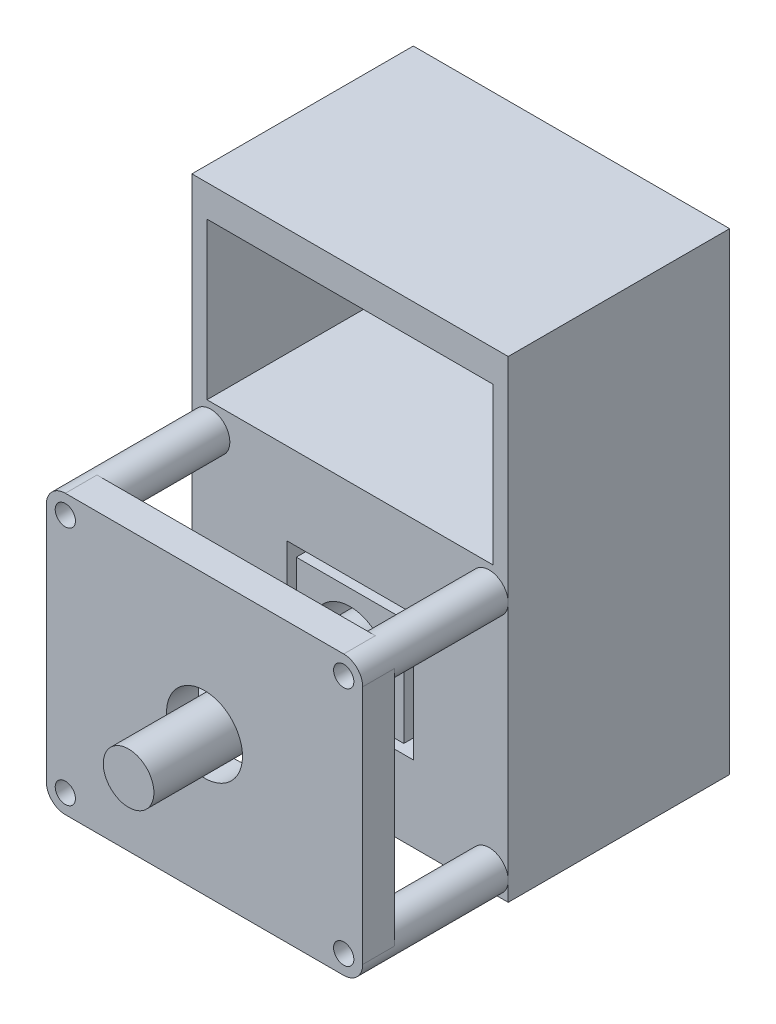
from build123d import *

# Parameters (mm, degrees)
SKETCH_2_W           = 50
SKETCH_2_H           = 74.720339059
SKETCH_2_R           = 1.6
SKETCH_2_W_2         = 20
SKETCH_2_H_2         = 20
SKETCH_2_W_3         = 45.23
SKETCH_2_H_3         = 24.73
EXTRUDE_1_DEPTH      = 35
SKETCH_2_W_4         = 17
SKETCH_2_H_4         = 17
SKETCH_2_R_2         = 6
EXTRUDE_1_2_DEPTH    = 35
EXTRUDE_2_DEPTH      = 35
EXTRUDE_2_DEPTH_BACK = 37
SKETCH_3_R           = 4
SKETCH_6_R           = 3
SKETCH_6_R_2         = 1.6
EXTRUDE_3_DEPTH      = 18
EXTRUDE_3_2_DEPTH    = 18
EXTRUDE_3_3_DEPTH    = 18
EXTRUDE_3_4_DEPTH    = 18
EXTRUDE_START        = 5
SKETCH_7_R           = 1.6
SKETCH_7_R_2         = 6
EXTRUDE_4_DEPTH      = 5


with BuildPart() as part:
    # ｽｹｯﾁ2 → ﾎﾞｽ - 押し出し1 (new body)
    with BuildSketch(Plane.XY):
        with Locations((0, 15.36016953)):
            Rectangle(SKETCH_2_W, SKETCH_2_H)
        with Locations((-22, 19)):
            Circle(SKETCH_2_R, mode=Mode.SUBTRACT)
        with Locations((-22, -19)):
            Circle(SKETCH_2_R, mode=Mode.SUBTRACT)
        with Locations((22, -19)):
            Circle(SKETCH_2_R, mode=Mode.SUBTRACT)
        with Locations((22, 19)):
            Circle(SKETCH_2_R, mode=Mode.SUBTRACT)
        Rectangle(SKETCH_2_W_2, SKETCH_2_H_2, mode=Mode.SUBTRACT)
        with Locations((0, 35.355339059)):
            Rectangle(SKETCH_2_W_3, SKETCH_2_H_3, mode=Mode.SUBTRACT)
    extrude(amount=-EXTRUDE_1_DEPTH)


with BuildPart() as body_2:
    # ｽｹｯﾁ2 → Extrude 1 2 (new body)
    with BuildSketch(Plane.XY):
        Rectangle(SKETCH_2_W_4, SKETCH_2_H_4)
        Circle(SKETCH_2_R_2, mode=Mode.SUBTRACT)
    extrude(amount=-EXTRUDE_1_2_DEPTH)


with BuildPart() as body_3:
    # ｽｹｯﾁ3 → ﾎﾞｽ - 押し出し2 (new, two sides: drawn at the far end of the back side and taken through both)
    with BuildSketch(Plane.XY.offset(-EXTRUDE_2_DEPTH_BACK)):
        Circle(SKETCH_3_R)
    extrude(amount=EXTRUDE_2_DEPTH + EXTRUDE_2_DEPTH_BACK)


with BuildPart() as body_4:
    # ｽｹｯﾁ6 → ﾎﾞｽ - 押し出し3 (new body)
    with BuildSketch(Plane.XY):
        with Locations((-22, 19)):
            Circle(SKETCH_6_R)
        with Locations((-22, 19)):
            Circle(SKETCH_6_R_2, mode=Mode.SUBTRACT)
    extrude(amount=EXTRUDE_3_DEPTH)



with BuildPart() as body_5:
    # ｽｹｯﾁ6 → Extrude 3 2 (new body)
    with BuildSketch(Plane.XY):
        with Locations(Location((-22, -19, 0), (0, 0, 180))):
            Circle(SKETCH_6_R)
        with Locations((-22, -19)):
            Circle(SKETCH_6_R_2, mode=Mode.SUBTRACT)
    extrude(amount=EXTRUDE_3_2_DEPTH)


with BuildPart() as body_6:
    # ｽｹｯﾁ6 → Extrude 3 3 (new body)
    with BuildSketch(Plane.XY):
        with Locations((22, -19)):
            Circle(SKETCH_6_R)
        with Locations((22, -19)):
            Circle(SKETCH_6_R_2, mode=Mode.SUBTRACT)
    extrude(amount=EXTRUDE_3_3_DEPTH)


with BuildPart() as body_7:
    # ｽｹｯﾁ6 → Extrude 3 4 (new body)
    with BuildSketch(Plane.XY):
        with Locations(Location((22, 19, 0), (0, 0, 180))):
            Circle(SKETCH_6_R)
        with Locations((22, 19)):
            Circle(SKETCH_6_R_2, mode=Mode.SUBTRACT)
    extrude(amount=EXTRUDE_3_4_DEPTH)


with BuildPart() as body_4_1:
    add(body_4.part)

    add(body_5.part)  # ﾎﾞｽ - 押し出し4 merges body 5

    add(body_6.part)  # ﾎﾞｽ - 押し出し4 merges body 6

    add(body_7.part)  # ﾎﾞｽ - 押し出し4 merges body 7
    # ｽｹｯﾁ7 → ﾎﾞｽ - 押し出し4 (add)
    with BuildSketch(Plane.XY.offset(18).offset(EXTRUDE_START)):
        with BuildLine():
            Line((-22, 22), (22, 22))
            ThreePointArc((22, 22), (24.121320344, 21.121320344), (25, 19))
            Line((25, 19), (25, -19))
            ThreePointArc((25, -19), (24.121320344, -21.121320344), (22, -22))
            Line((22, -22), (-22, -22))
            ThreePointArc((-22, -22), (-24.121320344, -21.121320344), (-25, -19))
            Line((-25, -19), (-25, 19))
            ThreePointArc((-25, 19), (-24.121320344, 21.121320344), (-22, 22))
        make_face()
        with Locations(Location((-22, -19, 0), (0, 0, 180))):
            Circle(SKETCH_7_R, mode=Mode.SUBTRACT)
        with Locations((22, -19)):
            Circle(SKETCH_7_R, mode=Mode.SUBTRACT)
        with Locations(Location((22, 19, 0), (0, 0, 180))):
            Circle(SKETCH_7_R, mode=Mode.SUBTRACT)
        with Locations((-22, 19)):
            Circle(SKETCH_7_R, mode=Mode.SUBTRACT)
        Circle(SKETCH_7_R_2, mode=Mode.SUBTRACT)
    extrude(amount=-EXTRUDE_4_DEPTH)


solid = Compound([part.part, body_2.part, body_3.part, body_4_1.part])
